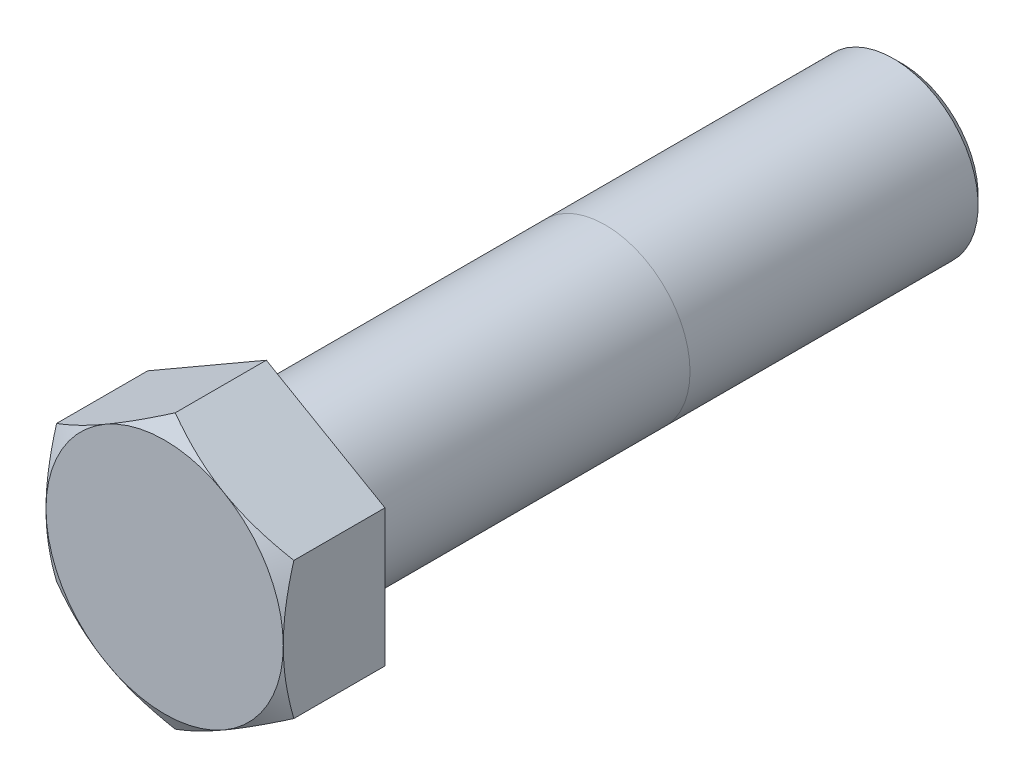
from build123d import *

# Parameters (mm, degrees)
BOSS_EXTRUDE1_DEPTH = 12
SKETCH2_OUTSIDE_W   = 80.454
SKETCH2_OUTSIDE_H   = 84.786
SKETCH2_OUTSIDE_R   = 14
CUT_EXTRUDE1_DEPTH  = 12
CUT_EXTRUDE1_DRAFT  = -60
SKETCH3_R           = 10
BOSS_EXTRUDE2_DEPTH = 75
CHAMFER1_SIZE       = 1


with BuildPart() as part:
    # Sketch1 → Boss-Extrude1 (new body)
    with BuildSketch(Plane.XY):
        Polygon((0, -16.165807537), (14, -8.082903769), (14, 8.082903769), (0, 16.165807537), (-14, 8.082903769), (-14, -8.082903769), align=None)
    extrude(amount=BOSS_EXTRUDE1_DEPTH)


with BuildPart() as cut_extrude1_tool:
    # Sketch2 outside → Cut-Extrude1 (with draft: the straight prism first)
    with BuildSketch(Plane.XY.offset(12)):
        Rectangle(SKETCH2_OUTSIDE_W, SKETCH2_OUTSIDE_H)
        Circle(SKETCH2_OUTSIDE_R, mode=Mode.SUBTRACT)
    extrude(amount=-CUT_EXTRUDE1_DEPTH)
    # Cut-Extrude1: the draft: its side faces are tilted about the plane it starts from
    cut_extrude1_sides = [cut_extrude1_tool.faces().sort_by_distance(p)[0] for p in [
        (0, -42.393, 6),
        (40.227, 0, 6),
        (0, 42.393, 6),
        (-40.227, 0, 6),
        (-14, 0, 6),
    ]]
    draft(cut_extrude1_sides, Plane.XY.offset(12), CUT_EXTRUDE1_DRAFT)


with BuildPart() as part_1:
    add(part.part)

    # Cut-Extrude1: cut by cut_extrude1_tool
    add(cut_extrude1_tool.part, mode=Mode.SUBTRACT)

    # Sketch3 → Boss-Extrude2 (add)
    with BuildSketch(Plane(origin=(0, 0, 0), x_dir=(-1, 0, 0), z_dir=(0, 0, -1))):
        Circle(SKETCH3_R)
    extrude(amount=BOSS_EXTRUDE2_DEPTH)

    # Chamfer1
    chamfer1_edges = [part_1.edges().sort_by_distance(p)[0] for p in [
        (10, 0, -75),
    ]]
    chamfer(chamfer1_edges, length=CHAMFER1_SIZE)


solid = part_1.part
